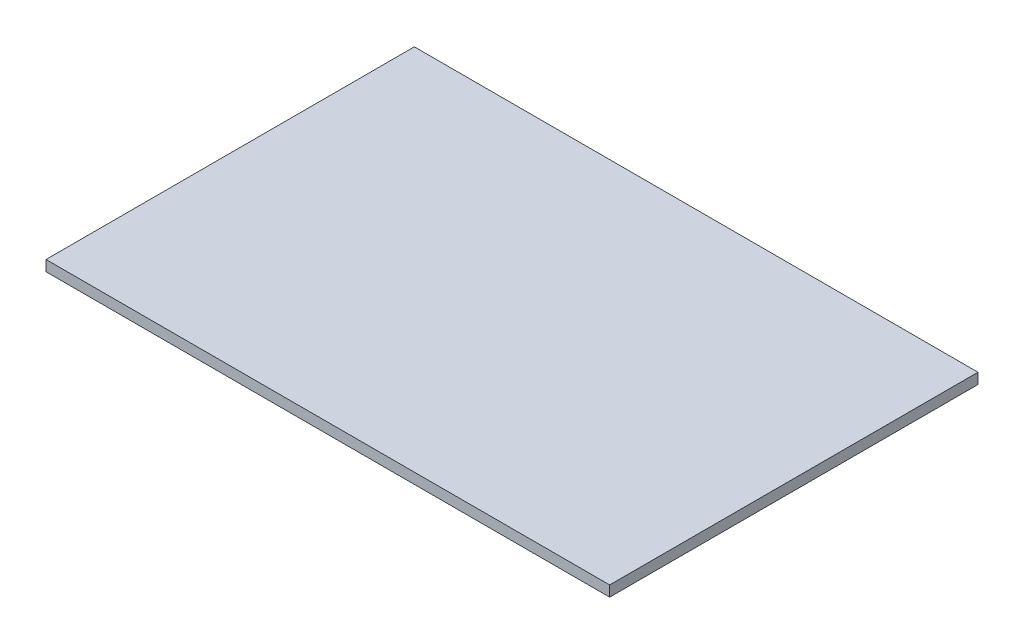
from build123d import *

# Parameters (mm, degrees)
SKETCH1_W           = 83.566
SKETCH1_H           = 54.61
BOSS_EXTRUDE1_DEPTH = 1.5748


with BuildPart() as part:
    # Sketch1 → Boss-Extrude1 (new body)
    with BuildSketch(Plane(origin=(0, 0, 0), x_dir=(1, 0, 0), z_dir=(0, 1, 0))):
        Rectangle(SKETCH1_W, SKETCH1_H)
    extrude(amount=BOSS_EXTRUDE1_DEPTH)


solid = part.part
